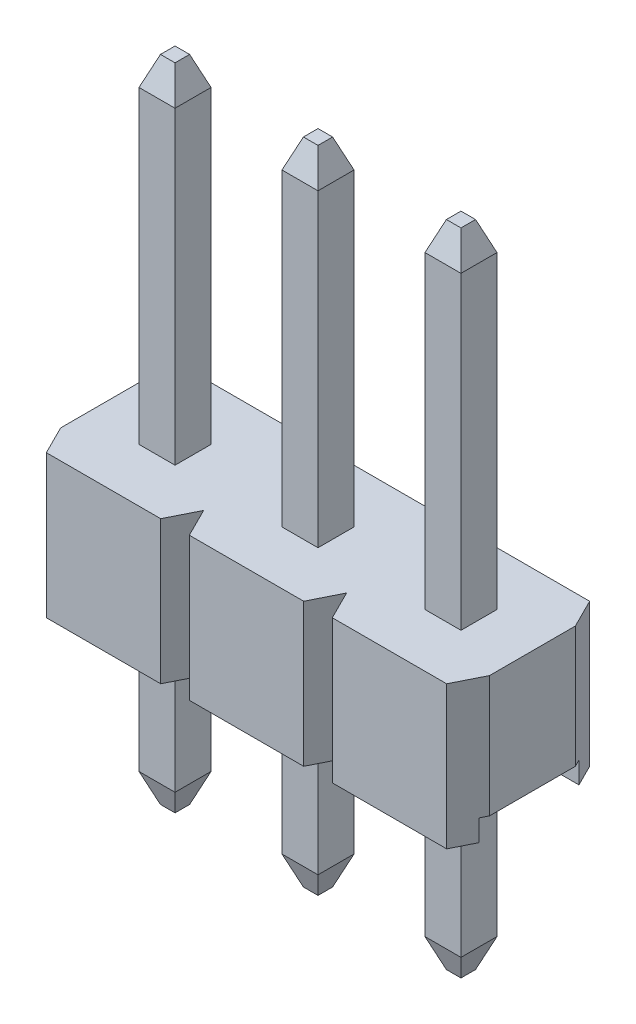
from build123d import *
from OCP.BRepFilletAPI import BRepFilletAPI_MakeChamfer

# Parameters (mm, degrees)
SKETCH1_W                     = 2.54
SKETCH1_H                     = 2.54
MAIN_BODY_DEPTH               = 2.54
SKETCH3_W                     = 1.778
SKETCH3_H                     = 0.381
CUT_EXTRUDE1_DEPTH            = 5.399409051
CUT_EXTRUDE2_DEPTH            = 5.399409051
BODY_PATTERN_COUNT            = 3
BODY_PATTERN_PITCH            = 2.54
PIN_START                     = -5.54
SKETCH2_W                     = 0.64
SKETCH2_H                     = 0.64
PIN_DEPTH                     = 11.54
CHAMFER1_SIZE                 = 0.508
CHAMFER1_SIZE2                = 0.1905
CHAMFER2_SIZE                 = 0.1905
CHAMFER2_SIZE2                = 0.508
PIN_PATTERN_COUNT             = 3
PIN_PATTERN_PITCH             = 2.54
CHAMFER1_OF_PIN_PATTERN_SIZE  = 0.508
CHAMFER1_OF_PIN_PATTERN_SIZE2 = 0.1905
CHAMFER2_OF_PIN_PATTERN_SIZE2 = 0.1905
CHAMFER2_OF_PIN_PATTERN_SIZE  = 0.508


with BuildPart() as part:
    # Sketch1 → Main Body (new body)
    with BuildSketch(Plane(origin=(0, 0, 0), x_dir=(1, 0, 0), z_dir=(0, 1, 0))):
        with Locations((1.27, 1.27)):
            Rectangle(SKETCH1_W, SKETCH1_H)
    main_body = extrude(amount=MAIN_BODY_DEPTH)

    # Sketch3 → Cut-Extrude1 (cut, through all)
    with BuildSketch(Plane.ZY):
        with Locations((-1.27, 0.1905)):
            Rectangle(SKETCH3_W, SKETCH3_H)
    cut_extrude1 = extrude(amount=-CUT_EXTRUDE1_DEPTH, mode=Mode.SUBTRACT)

    # Sketch4 → Cut-Extrude2 (cut, through all)
    with BuildSketch(Plane(origin=(0, 2.54, 0), x_dir=(1, 0, 0), z_dir=(0, 1, 0))):
        Polygon((0.254, 2.54), (0, 2.54), (0, 2.032), align=None)
        Polygon((2.54, 2.54), (2.286, 2.54), (2.54, 2.032), align=None)
        Polygon((0.254, 0), (0, 0.508), (0, 0), align=None)
        Polygon((2.54, 0), (2.286, 0), (2.54, 0.508), align=None)
    cut_extrude2 = extrude(amount=-CUT_EXTRUDE2_DEPTH, mode=Mode.SUBTRACT)

    # Body Pattern: Main Body, Cut-Extrude1, Cut-Extrude2 ×3
    with Locations(*[(-i * BODY_PATTERN_PITCH, 0, 0) for i in range(1, BODY_PATTERN_COUNT)]):
        add(main_body)
        add(cut_extrude1, mode=Mode.SUBTRACT)
        add(cut_extrude2, mode=Mode.SUBTRACT)

    # Sketch2 → Pin (add)
    with BuildSketch(Plane(origin=(0, 2.54, 0), x_dir=(1, 0, 0), z_dir=(0, 1, 0)).offset(PIN_START)):
        with Locations((1.27, 1.27)):
            Rectangle(SKETCH2_W, SKETCH2_H)
    pin = extrude(amount=PIN_DEPTH)

    # Chamfer1: one chamfer whose edges measure the first distance from different faces: ONE call of the kernel's chamfer builder (chamfer() names one face for all edges)
    chamfer1_edges_1 = [part.edges().sort_by_distance(p)[0] for p in [
        (0.95, 8.54, -1.27),
    ]]
    chamfer1_side_1 = [part.faces().sort_by_distance(p)[0] for p in [
        (0.95, 5.54, -1.27),
    ]]
    chamfer1_edges_2 = [part.edges().sort_by_distance(p)[0] for p in [
        (1.27, 8.54, -0.95),
    ]]
    chamfer1_side_2 = [part.faces().sort_by_distance(p)[0] for p in [
        (1.27, 5.54, -0.95),
    ]]
    chamfer1_edges_3 = [part.edges().sort_by_distance(p)[0] for p in [
        (1.59, 8.54, -1.27),
    ]]
    chamfer1_side_3 = [part.faces().sort_by_distance(p)[0] for p in [
        (1.59, 5.54, -1.27),
    ]]
    chamfer1_edges_4 = [part.edges().sort_by_distance(p)[0] for p in [
        (1.27, 8.54, -1.59),
    ]]
    chamfer1_side_4 = [part.faces().sort_by_distance(p)[0] for p in [
        (1.27, 5.54, -1.59),
    ]]
    chamfer1 = BRepFilletAPI_MakeChamfer(part.part.solid().wrapped)
    for e in chamfer1_edges_1:
        chamfer1.Add(CHAMFER1_SIZE, CHAMFER1_SIZE2, e.wrapped, chamfer1_side_1[0].wrapped)  # the first distance lies on this face
    for e in chamfer1_edges_2:
        chamfer1.Add(CHAMFER1_SIZE, CHAMFER1_SIZE2, e.wrapped, chamfer1_side_2[0].wrapped)  # the first distance lies on this face
    for e in chamfer1_edges_3:
        chamfer1.Add(CHAMFER1_SIZE, CHAMFER1_SIZE2, e.wrapped, chamfer1_side_3[0].wrapped)  # the first distance lies on this face
    for e in chamfer1_edges_4:
        chamfer1.Add(CHAMFER1_SIZE, CHAMFER1_SIZE2, e.wrapped, chamfer1_side_4[0].wrapped)  # the first distance lies on this face
    add(Compound.cast(chamfer1.Shape()), mode=Mode.REPLACE)

    # Chamfer2
    chamfer2_edges = [part.edges().sort_by_distance(p)[0] for p in [
        (1.27, -3, -0.95),
        (1.59, -3, -1.27),
        (1.27, -3, -1.59),
        (0.95, -3, -1.27),
    ]]
    chamfer2_side = [part.faces().sort_by_distance(p)[0] for p in [
        (1.27, -3, -1.27),
    ]]
    chamfer(chamfer2_edges, length=CHAMFER2_SIZE, length2=CHAMFER2_SIZE2, reference=chamfer2_side[0])

    # Pin Pattern: Pin ×3
    with Locations(*[(-i * PIN_PATTERN_PITCH, 0, 0) for i in range(1, PIN_PATTERN_COUNT)]):
        add(pin)

    # Chamfer1 of Pin Pattern: one chamfer whose edges measure the first distance from different faces: ONE call of the kernel's chamfer builder (chamfer() names one face for all edges)
    chamfer1_of_pin_pattern_edges_1 = [part.edges().sort_by_distance(p)[0] for p in [
        (-1.59, 8.54, -1.27),
    ]]
    chamfer1_of_pin_pattern_side_1 = [part.faces().sort_by_distance(p)[0] for p in [
        (-1.59, 5.54, -1.27),
    ]]
    chamfer1_of_pin_pattern_edges_2 = [part.edges().sort_by_distance(p)[0] for p in [
        (-1.27, 8.54, -0.95),
    ]]
    chamfer1_of_pin_pattern_side_2 = [part.faces().sort_by_distance(p)[0] for p in [
        (-1.27, 5.54, -0.95),
    ]]
    chamfer1_of_pin_pattern_edges_3 = [part.edges().sort_by_distance(p)[0] for p in [
        (-0.95, 8.54, -1.27),
    ]]
    chamfer1_of_pin_pattern_side_3 = [part.faces().sort_by_distance(p)[0] for p in [
        (-0.95, 5.54, -1.27),
    ]]
    chamfer1_of_pin_pattern_edges_4 = [part.edges().sort_by_distance(p)[0] for p in [
        (-1.27, 8.54, -1.59),
    ]]
    chamfer1_of_pin_pattern_side_4 = [part.faces().sort_by_distance(p)[0] for p in [
        (-1.27, 5.54, -1.59),
    ]]
    chamfer1_of_pin_pattern_edges_5 = [part.edges().sort_by_distance(p)[0] for p in [
        (-4.13, 8.54, -1.27),
    ]]
    chamfer1_of_pin_pattern_side_5 = [part.faces().sort_by_distance(p)[0] for p in [
        (-4.13, 5.54, -1.27),
    ]]
    chamfer1_of_pin_pattern_edges_6 = [part.edges().sort_by_distance(p)[0] for p in [
        (-3.81, 8.54, -0.95),
    ]]
    chamfer1_of_pin_pattern_side_6 = [part.faces().sort_by_distance(p)[0] for p in [
        (-3.81, 5.54, -0.95),
    ]]
    chamfer1_of_pin_pattern_edges_7 = [part.edges().sort_by_distance(p)[0] for p in [
        (-3.49, 8.54, -1.27),
    ]]
    chamfer1_of_pin_pattern_side_7 = [part.faces().sort_by_distance(p)[0] for p in [
        (-3.49, 5.54, -1.27),
    ]]
    chamfer1_of_pin_pattern_edges_8 = [part.edges().sort_by_distance(p)[0] for p in [
        (-3.81, 8.54, -1.59),
    ]]
    chamfer1_of_pin_pattern_side_8 = [part.faces().sort_by_distance(p)[0] for p in [
        (-3.81, 5.54, -1.59),
    ]]
    chamfer1_of_pin_pattern = BRepFilletAPI_MakeChamfer(part.part.solid().wrapped)
    for e in chamfer1_of_pin_pattern_edges_1:
        chamfer1_of_pin_pattern.Add(CHAMFER1_OF_PIN_PATTERN_SIZE, CHAMFER1_OF_PIN_PATTERN_SIZE2, e.wrapped, chamfer1_of_pin_pattern_side_1[0].wrapped)  # the first distance lies on this face
    for e in chamfer1_of_pin_pattern_edges_2:
        chamfer1_of_pin_pattern.Add(CHAMFER1_OF_PIN_PATTERN_SIZE, CHAMFER1_OF_PIN_PATTERN_SIZE2, e.wrapped, chamfer1_of_pin_pattern_side_2[0].wrapped)  # the first distance lies on this face
    for e in chamfer1_of_pin_pattern_edges_3:
        chamfer1_of_pin_pattern.Add(CHAMFER1_OF_PIN_PATTERN_SIZE, CHAMFER1_OF_PIN_PATTERN_SIZE2, e.wrapped, chamfer1_of_pin_pattern_side_3[0].wrapped)  # the first distance lies on this face
    for e in chamfer1_of_pin_pattern_edges_4:
        chamfer1_of_pin_pattern.Add(CHAMFER1_OF_PIN_PATTERN_SIZE, CHAMFER1_OF_PIN_PATTERN_SIZE2, e.wrapped, chamfer1_of_pin_pattern_side_4[0].wrapped)  # the first distance lies on this face
    for e in chamfer1_of_pin_pattern_edges_5:
        chamfer1_of_pin_pattern.Add(CHAMFER1_OF_PIN_PATTERN_SIZE, CHAMFER1_OF_PIN_PATTERN_SIZE2, e.wrapped, chamfer1_of_pin_pattern_side_5[0].wrapped)  # the first distance lies on this face
    for e in chamfer1_of_pin_pattern_edges_6:
        chamfer1_of_pin_pattern.Add(CHAMFER1_OF_PIN_PATTERN_SIZE, CHAMFER1_OF_PIN_PATTERN_SIZE2, e.wrapped, chamfer1_of_pin_pattern_side_6[0].wrapped)  # the first distance lies on this face
    for e in chamfer1_of_pin_pattern_edges_7:
        chamfer1_of_pin_pattern.Add(CHAMFER1_OF_PIN_PATTERN_SIZE, CHAMFER1_OF_PIN_PATTERN_SIZE2, e.wrapped, chamfer1_of_pin_pattern_side_7[0].wrapped)  # the first distance lies on this face
    for e in chamfer1_of_pin_pattern_edges_8:
        chamfer1_of_pin_pattern.Add(CHAMFER1_OF_PIN_PATTERN_SIZE, CHAMFER1_OF_PIN_PATTERN_SIZE2, e.wrapped, chamfer1_of_pin_pattern_side_8[0].wrapped)  # the first distance lies on this face
    add(Compound.cast(chamfer1_of_pin_pattern.Shape()), mode=Mode.REPLACE)

    # Chamfer2 of Pin Pattern
    chamfer2_of_pin_pattern_edges = [part.edges().sort_by_distance(p)[0] for p in [
        (-1.27, -3, -0.95),
        (-0.95, -3, -1.27),
        (-1.27, -3, -1.59),
        (-1.59, -3, -1.27),
        (-3.81, -3, -0.95),
        (-3.49, -3, -1.27),
        (-3.81, -3, -1.59),
        (-4.13, -3, -1.27),
    ]]
    chamfer(chamfer2_of_pin_pattern_edges, length=CHAMFER2_OF_PIN_PATTERN_SIZE, length2=CHAMFER2_OF_PIN_PATTERN_SIZE2)


solid = part.part
